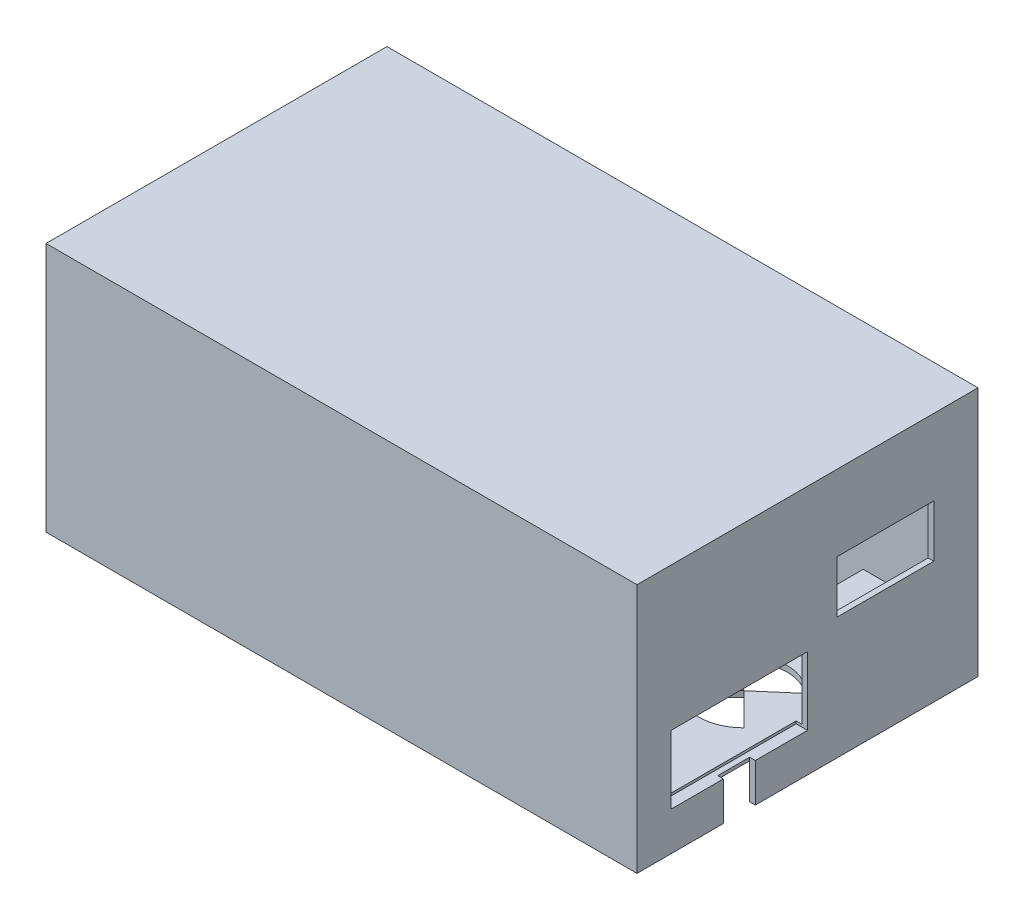
from build123d import *

# Parameters (mm, degrees)
SKETCH1_W               = 260
SKETCH1_H               = 150
SKETCH1_W_2             = 255
SKETCH1_H_2             = 145
BOSS_EXTRUDE1_DEPTH     = 110
SKETCH2_W               = 255
SKETCH2_H               = 145
BOSS_EXTRUDE2_DEPTH     = 2.5
SKETCH4_W               = 145
SKETCH4_H               = 2.5
BOSS_EXTRUDE3_DEPTH     = 45.5
CUT_EXTRUDE_THIN4_DEPTH = 5
SKETCH6_W               = 60
SKETCH6_H               = 30
CUT_EXTRUDE1_DEPTH      = 5
BOSS_EXTRUDE4_REACH     = 294.104
CUT_EXTRUDE2_DEPTH      = 3
SKETCH10_W              = 42.57
SKETCH10_H              = 23
CUT_EXTRUDE3_DEPTH      = 2.5
CUT_EXTRUDE4_DEPTH      = 2.5


with BuildPart() as part:
    # Sketch1 → Boss-Extrude1 (new body)
    with BuildSketch(Plane(origin=(0, 0, 0), x_dir=(1, 0, 0), z_dir=(0, 1, 0))):
        with Locations((130, 75)):
            Rectangle(SKETCH1_W, SKETCH1_H)
        with Locations((130, 75)):
            Rectangle(SKETCH1_W_2, SKETCH1_H_2, mode=Mode.SUBTRACT)
    extrude(amount=-BOSS_EXTRUDE1_DEPTH)

    # Sketch2 → Boss-Extrude2 (add)
    with BuildSketch(Plane(origin=(0, 0, 0), x_dir=(1, 0, 0), z_dir=(0, 1, 0))):
        with Locations((130, 75)):
            Rectangle(SKETCH2_W, SKETCH2_H)
    extrude(amount=-BOSS_EXTRUDE2_DEPTH)

    # Sketch4 → Boss-Extrude3 (add)
    with BuildSketch(Plane.ZY.offset(-257.5)):
        with Locations((-75, -93.15)):
            Rectangle(SKETCH4_W, SKETCH4_H)
    extrude(amount=BOSS_EXTRUDE3_DEPTH)

    # Sketch5 → Cut-Extrude-Thin4 (cut)
    with BuildSketch(Plane.XZ.offset(94.4)):
        Polygon((217.857864376, -60.857864376), (232, -75), (246.142135624, -60.857864376), (257.5, -60.857864376), (257.5, -60.858864376), (246.142549837, -60.858864376), (232, -75.001414214), (217.857157269, -60.858571483), align=None)
        with BuildLine():
            ThreePointArc((246.141113376, -60.858886624), (232, -55.001445677), (217.858886624, -60.858886624))
            Line((217.858886624, -60.858886624), (217.858179517, -60.858179517))
            ThreePointArc((217.858179517, -60.858179517), (232, -55.000445677), (246.141820483, -60.858179517))
            Line((246.141820483, -60.858179517), (246.141113376, -60.858886624))
        make_face()
    extrude(amount=-CUT_EXTRUDE_THIN4_DEPTH, mode=Mode.SUBTRACT)


with BuildPart() as cut_extrude_thin4_kept_piece:
    # of the separate pieces the step leaves, the one the design keeps (cut_extrude_thin4_pieces_kept)
    add(part.part.solids().sort_by_distance((0, 0, 0))[0])

    # Sketch6 → Cut-Extrude1 (cut)
    with BuildSketch(Plane(origin=(260, 0, 0), x_dir=(0, 0, -1), z_dir=(1, 0, 0))):
        with Locations((45, -78)):
            Rectangle(SKETCH6_W, SKETCH6_H)
    extrude(amount=-CUT_EXTRUDE1_DEPTH, mode=Mode.SUBTRACT)

    # Sketch8 → Boss-Extrude4 (add, up to next)
    with BuildSketch(Plane.XY.offset(-75), mode=Mode.PRIVATE) as boss_extrude4_sk1:
        Polygon((260, -63), (257.5, -64.647820306), (257.5, -63), align=None)
    boss_extrude4_tool1 = extrude(boss_extrude4_sk1.sketch, amount=BOSS_EXTRUDE4_REACH, mode=Mode.PRIVATE) - cut_extrude_thin4_kept_piece.part
    add(boss_extrude4_tool1.solids().sort_by_distance((258.333333, -63.549273, -75))[0])

    # Sketch9 → Cut-Extrude2 (cut)
    with BuildSketch(Plane.XZ.offset(94.4)):
        with BuildLine():
            Line((232, -75), (246.479283082, -87.467045982))
            ThreePointArc((246.479283082, -87.467045982), (232, -94.106984956), (217.520716918, -87.467045982))
            Line((217.520716918, -87.467045982), (232, -75))
        make_face()
    extrude(amount=-CUT_EXTRUDE2_DEPTH, mode=Mode.SUBTRACT)

    # Sketch10 → Cut-Extrude3 (cut)
    with BuildSketch(Plane(origin=(260, 0, 0), x_dir=(0, 0, -1), z_dir=(1, 0, 0))):
        with Locations((109.285, -44.84)):
            Rectangle(SKETCH10_W, SKETCH10_H)
    extrude(amount=-CUT_EXTRUDE3_DEPTH, mode=Mode.SUBTRACT)

    # Sketch11 → Cut-Extrude4 (cut)
    with BuildSketch(Plane(origin=(260, 0, 0), x_dir=(0, 0, -1), z_dir=(1, 0, 0))):
        Polygon((45, -93), (37.965, -93), (37.965, -110), (52.035, -110), (52.035, -93), align=None)
    extrude(amount=-CUT_EXTRUDE4_DEPTH, mode=Mode.SUBTRACT)


solid = cut_extrude_thin4_kept_piece.part
